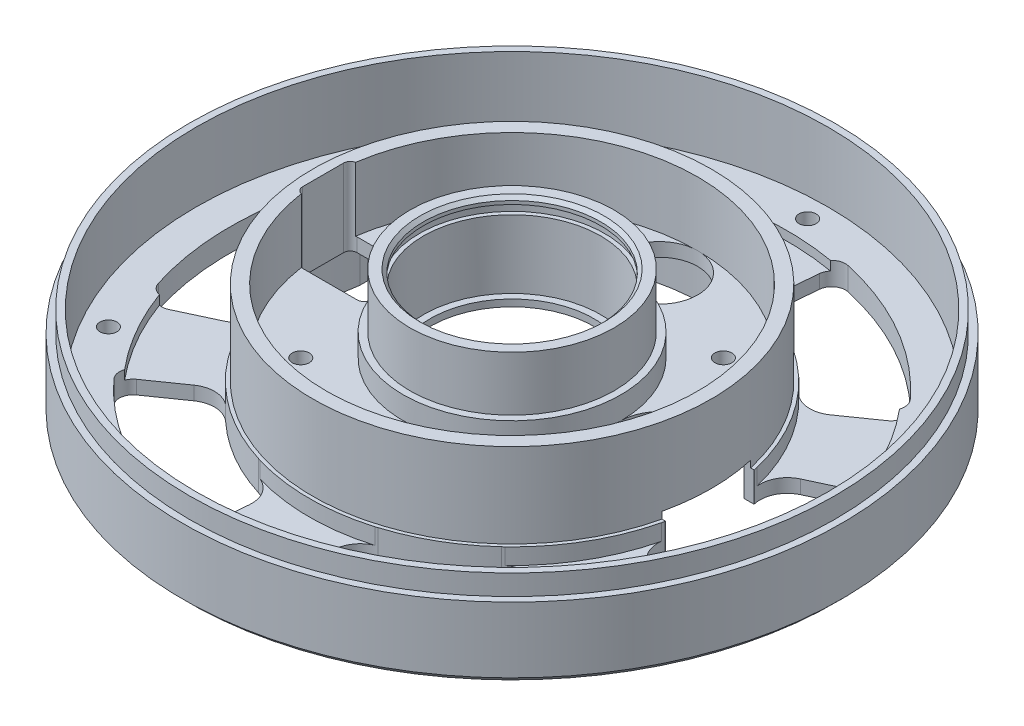
from build123d import *
from build123d.topology import SkipClean

# Parameters (mm, degrees)
SKETCH6_W                       = 2
SKETCH6_H                       = 9.38302555
SKETCH10_W                      = 1
SKETCH10_H                      = 3.3
SKETCH12_R                      = 5.625
CUT_EXTRUDE2_DEPTH              = 70.178717826
CIRPATTERN3_COUNT               = 4
SKETCH8_R                       = 3.5
BOSS_EXTRUDE1_DEPTH             = 3.85
M3X0_5_TAPPED_HOLE1_D           = 2.5
M3X0_5_TAPPED_HOLE3_D           = 2.5
M3X0_5_TAPPED_HOLE3_CSINK_D     = 3.5
M3X0_5_TAPPED_HOLE3_CSINK_ANGLE = 90
CIRPATTERN4_COUNT               = 6
CUT_EXTRUDE8_DEPTH              = 70.178717826
CIRPATTERN5_COUNT               = 6
SKETCH31_W                      = 8.166112118
SKETCH31_H                      = 1.3
CHAMFER1_SIZE                   = 0.5
CUT_EXTRUDE14_DEPTH             = 70.178717826
CUT_EXTRUDE14_DEPTH_BACK        = 70.178717826
CUT_EXTRUDE15_START             = -10.5
SKETCH33_W                      = 7.585482367
SKETCH33_H                      = 13
CUT_EXTRUDE15_DEPTH             = 5.35
BOSS_EXTRUDE2_DEPTH             = 2.35
CUT_EXTRUDE16_START             = -10.5
CUT_EXTRUDE16_DEPTH             = 5.35


with BuildPart() as part:
    # Sketch1 → Revolve1 (revolve)
    with BuildSketch(Plane.XY, mode=Mode.PRIVATE) as revolve1_sk:
        Polygon((-13, 8.15), (-13, -4.15), (-12, -4.15), (-12, -5.15), (-28.25, -5.15), (-28.25, -3.15), (-14.98, -3.15), (-14.98, 8.15), align=None)
    revolve(revolve1_sk.sketch.rotate(Axis((0, 0, 0), (0, -1, 0)), 270), axis=Axis((0, 0, 0), (0, -1, 0)))

    # Sketch4 → Revolve2 (revolve)
    with BuildSketch(Plane.XY, mode=Mode.PRIVATE) as revolve2_sk:
        Polygon((-29.75, -8.5), (-40.35, -8.5), (-40.35, -7.15), (-46.35, -7.15), (-46.35, 3), (-47.35, 3), (-47.35, 0), (-48.35, 0), (-48.35, -9.623470525), (-47.473470525, -10.5), (-28.25, -10.5), (-28.25, -5.15), (-26.25, -5.15), (-26.25, -3.15), (-29.23, -3.15), (-29.23, -6.136071916), (-29.75, -6.136071916), align=None)
    revolve(revolve2_sk.sketch.rotate(Axis((0, 0, 0), (0, 1, 0)), 270), axis=Axis((0, 0, 0), (0, 1, 0)))

    # Sketch6 → Revolve3 (revolve)
    with BuildSketch(Plane.XY, mode=Mode.PRIVATE) as revolve3_sk:
        with Locations((-28.23, 1.541512775)):
            Rectangle(SKETCH6_W, SKETCH6_H)
    revolve(revolve3_sk.sketch.rotate(Axis((0, 0, 0), (0, 1, 0)), 270), axis=Axis((0, 0, 0), (0, 1, 0)))

    # Sketch7 → Revolve4 (revolve)
    with BuildSketch(Plane.XY, mode=Mode.PRIVATE) as revolve4_sk:
        Polygon((-29.717598702, -6.137598702), (-29.23, -6.137598702), (-29.23, -8.5), (-29.73, -8.5), (-29.73, -6.15), align=None)
    revolve(revolve4_sk.sketch.rotate(Axis((0, 0, 0), (0, 1, 0)), 270), axis=Axis((0, 0, 0), (0, 1, 0)))

    # Sketch10 → Revolve5 (revolve)
    with BuildSketch(Plane.XY, mode=Mode.PRIVATE) as revolve5_sk:
        with Locations((-15.48, -1.5)):
            Rectangle(SKETCH10_W, SKETCH10_H)
    revolve(revolve5_sk.sketch.rotate(Axis((0, 0, 0), (0, 1, 0)), 270), axis=Axis((0, 0, 0), (0, 1, 0)))

    # Sketch12 → Cut-Extrude2 (cut, through all)
    with BuildSketch(Plane(origin=(0, 0, 0), x_dir=(1, 0, 0), z_dir=(0, 1, 0))):
        with Locations(Location((21.605, 0, 0), (0, 0, 180))):
            Circle(SKETCH12_R)
    cut_extrude2 = extrude(amount=-CUT_EXTRUDE2_DEPTH, mode=Mode.SUBTRACT)

    # CirPattern3: Cut-Extrude2 ×4 about axis, 2 skipped
    cirpattern3_axis = Axis((0, 0, 0), (0, 1, 0))
    add([cut_extrude2.rotate(cirpattern3_axis, i * 360 / CIRPATTERN3_COUNT) for i in range(1, CIRPATTERN3_COUNT) if i not in (2, 3)], mode=Mode.SUBTRACT)

    # Sketch8 → Boss-Extrude1 (add)
    with BuildSketch(Plane.XZ.offset(5.15)):
        with Locations(Location((-15.5, 15.5, 0), (0, 0, 90))):
            Circle(SKETCH8_R)
        with Locations(Location((15.5, 15.5, 0), (0, 0, 90))):
            Circle(SKETCH8_R)
        with Locations(Location((15.5, -15.5, 0), (0, 0, 90))):
            Circle(SKETCH8_R)
        with Locations(Location((-15.5, -15.5, 0), (0, 0, 90))):
            Circle(SKETCH8_R)
    extrude(amount=BOSS_EXTRUDE1_DEPTH)

    # M3x0.5 Tapped Hole1 (through all)
    with Locations(Plane(origin=(0, -9, 0), x_dir=(-1, 0, 0), z_dir=(0, -1, 0))):
        with Locations((-15.5, 15.5), (15.5, 15.5), (15.5, -15.5), (-15.5, -15.5)):
            Hole(M3X0_5_TAPPED_HOLE1_D / 2)

    # M3x0.5 Tapped Hole3 (through all)
    with Locations(Plane(origin=(0, -10.5, 0), x_dir=(-1, 0, 0), z_dir=(0, -1, 0))):
        with Locations((0, 43.35)):
            m3x0_5_tapped_hole3 = CounterSinkHole(M3X0_5_TAPPED_HOLE3_D / 2, M3X0_5_TAPPED_HOLE3_CSINK_D / 2, counter_sink_angle=M3X0_5_TAPPED_HOLE3_CSINK_ANGLE)

    # CirPattern4: M3x0.5 Tapped Hole3 ×6 about axis
    cirpattern4_axis = Axis((0, 0, 0), (0, 1, 0))
    for i in range(1, CIRPATTERN4_COUNT):
        add(m3x0_5_tapped_hole3.rotate(cirpattern4_axis, i * 360 / CIRPATTERN4_COUNT), mode=Mode.SUBTRACT)

    # Sketch26 → Cut-Extrude8 (cut, symmetric)
    with BuildSketch(Plane(origin=(0, 0, 0), x_dir=(1, 0, 0), z_dir=(0, 1, 0))):
        with BuildLine():
            Line((31.195130186, 11.125231148), (36.672756326, 13.679490166))
            ThreePointArc((36.672756326, 13.679490166), (38.322654307, 13.697863378), (39.424879398, 12.470019425))
            ThreePointArc((39.424879398, 12.470019425), (41.35, 0), (39.424879398, -12.470019425))
            ThreePointArc((39.424879398, -12.470019425), (38.322654307, -13.697863378), (36.672756326, -13.679490166))
            Line((36.672756326, -13.679490166), (31.195130186, -11.125231148))
            ThreePointArc((31.195130186, -11.125231148), (29.292766374, -9.258272818), (28.985739227, -6.61058405))
            ThreePointArc((28.985739227, -6.61058405), (29.73, 0), (28.985739227, 6.61058405))
            ThreePointArc((28.985739227, 6.61058405), (29.292766374, 9.258272818), (31.195130186, 11.125231148))
        make_face()
    cut_extrude8 = extrude(amount=CUT_EXTRUDE8_DEPTH, both=True, mode=Mode.SUBTRACT)

    # CirPattern5: Cut-Extrude8 ×6 about axis
    cirpattern5_axis = Axis((0, 0, 0), (0, 1, 0))
    for i in range(1, CIRPATTERN5_COUNT):
        add(cut_extrude8.rotate(cirpattern5_axis, i * 360 / CIRPATTERN5_COUNT), mode=Mode.SUBTRACT)

    # Sketch31 → Cut-Revolve1 (revolve, cut)
    with BuildSketch(Plane.XY, mode=Mode.PRIVATE) as cut_revolve1_sk:
        with Locations((-9.516943941, 6.5)):
            Rectangle(SKETCH31_W, SKETCH31_H)
    revolve(cut_revolve1_sk.sketch.rotate(Axis((0, 0, 0), (0, -1, 0)), 270), axis=Axis((0, 0, 0), (0, -1, 0)), mode=Mode.SUBTRACT)

    # Chamfer1
    chamfer1_edges = [part.edges().sort_by_distance(p)[0] for p in [
        (0, 8.15, -13),
    ]]
    chamfer(chamfer1_edges, length=CHAMFER1_SIZE)

    # Sketch32 → Cut-Extrude14 (cut, two sides: drawn at the far end of the back side and taken through both)
    with SkipClean():  # the faces are left unmerged after this step: merging them gives an invalid solid
        with BuildSketch(Plane(origin=(0, 0, 0), x_dir=(1, 0, 0), z_dir=(0, 1, 0)).offset(-CUT_EXTRUDE14_DEPTH_BACK)):
            with BuildLine():
                Line((-18.73, 4), (-26.73, 4))
                ThreePointArc((-26.73, 4), (-27.437106781, 3.707106781), (-27.73, 3))
                Line((-27.73, 3), (-27.73, -3))
                ThreePointArc((-27.73, -3), (-27.437106781, -3.707106781), (-26.73, -4))
                Line((-26.73, -4), (-18.73, -4))
                ThreePointArc((-18.73, -4), (-18.022893219, -3.707106781), (-17.73, -3))
                Line((-17.73, -3), (-17.73, 3))
                ThreePointArc((-17.73, 3), (-18.022893219, 3.707106781), (-18.73, 4))
            make_face()
        extrude(amount=CUT_EXTRUDE14_DEPTH + CUT_EXTRUDE14_DEPTH_BACK, mode=Mode.SUBTRACT)

    # Sketch33 → Cut-Extrude15 (cut)
    with SkipClean():  # the faces are left unmerged after this step: merging them gives an invalid solid
        with BuildSketch(Plane(origin=(0, 0, 0), x_dir=(1, 0, 0), z_dir=(0, 1, 0)).offset(CUT_EXTRUDE15_START)):
            with Locations((29.551169273, 0)):
                Rectangle(SKETCH33_W, SKETCH33_H)
        extrude(amount=CUT_EXTRUDE15_DEPTH, mode=Mode.SUBTRACT)

    # Sketch34 → Boss-Extrude2 (add)
    with SkipClean():  # the faces are left unmerged after this step: merging them gives an invalid solid
        with BuildSketch(Plane.XZ.offset(5.15)):
            with BuildLine():
                Line((-1.8, 19), (4.2, 19))
                ThreePointArc((4.2, 19), (4.553553391, 18.853553391), (4.7, 18.5))
                Line((4.7, 18.5), (4.7, 12.5))
                ThreePointArc((4.7, 12.5), (4.553553391, 12.146446609), (4.2, 12))
                Line((4.2, 12), (-1.8, 12))
                ThreePointArc((-1.8, 12), (-2.153553391, 12.146446609), (-2.3, 12.5))
                Line((-2.3, 12.5), (-2.3, 18.5))
                ThreePointArc((-2.3, 18.5), (-2.153553391, 18.853553391), (-1.8, 19))
            make_face()
        extrude(amount=BOSS_EXTRUDE2_DEPTH)

    # Sketch35 → Cut-Extrude16 (cut)
    with SkipClean():  # the faces are left unmerged after this step: merging them gives an invalid solid
        with BuildSketch(Plane(origin=(0, 0, 0), x_dir=(1, 0, 0), z_dir=(0, 1, 0)).offset(CUT_EXTRUDE16_START)):
            with BuildLine():
                Line((-26.73, 7.5), (-21.294446142, 7.5))
                ThreePointArc((-21.294446142, 7.5), (-20.58733936, 7.207106781), (-20.294446142, 6.5))
                Line((-20.294446142, 6.5), (-20.294446142, -6.5))
                ThreePointArc((-20.294446142, -6.5), (-20.58733936, -7.207106781), (-21.294446142, -7.5))
                Line((-21.294446142, -7.5), (-26.73, -7.5))
                ThreePointArc((-26.73, -7.5), (-27.437106781, -7.207106781), (-27.73, -6.5))
                Line((-27.73, -6.5), (-27.73, 6.5))
                ThreePointArc((-27.73, 6.5), (-27.437106781, 7.207106781), (-26.73, 7.5))
            make_face()
        extrude(amount=CUT_EXTRUDE16_DEPTH, mode=Mode.SUBTRACT)


solid = part.part
